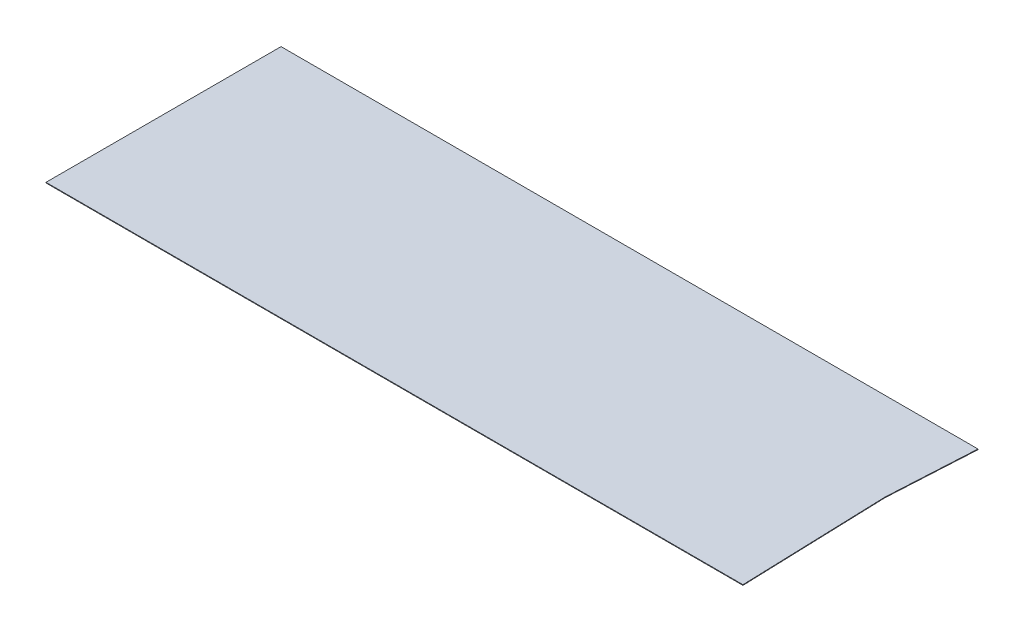
from build123d import *

# Parameters (mm, degrees)
BOSS_EXTRUDE1_DEPTH = 1.5875


with BuildPart() as part:
    # Sketch1 → Boss-Extrude1 (new body)
    with BuildSketch(Plane(origin=(0, 0, 0), x_dir=(1, 0, 0), z_dir=(0, 1, 0))):
        Polygon((909.766604996, -304.8), (897.066604996, 76.2), (909.766604996, 304.8), (-897.89, 304.8), (-897.89, -304.8), align=None)
    extrude(amount=BOSS_EXTRUDE1_DEPTH)


solid = part.part
